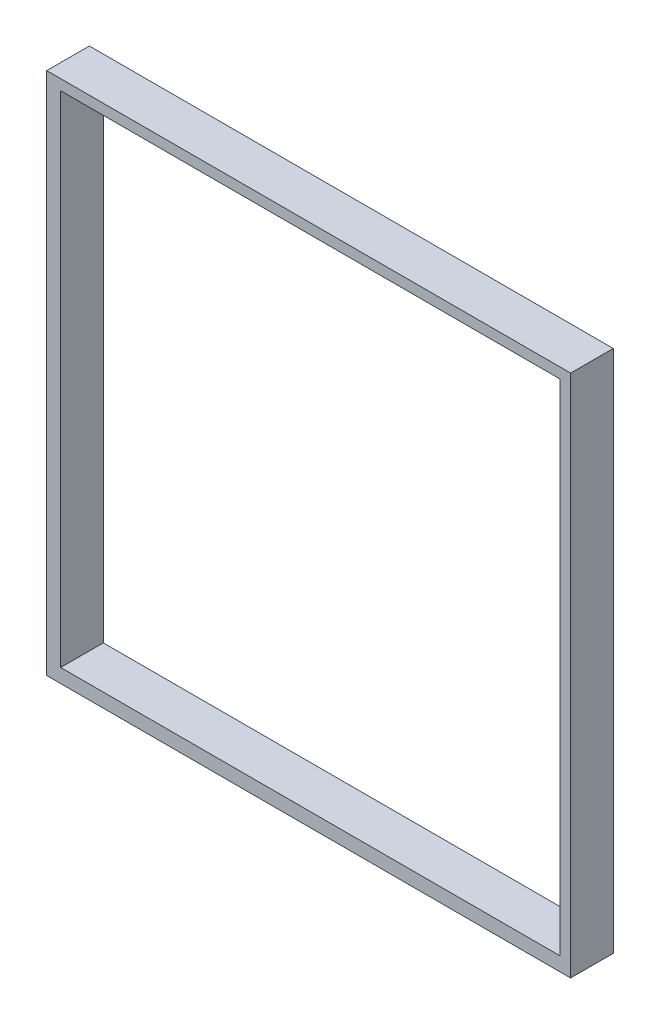
from build123d import *

# Parameters (mm, degrees)
SCHIZZO1_W                   = 43
SCHIZZO1_H                   = 43
ESTRUSIONE_ESTRUSIONE1_DEPTH = 3.5
SCHIZZO8_W                   = 41
SCHIZZO8_H                   = 41
TAGLIO_ESTRUSIONE1_DEPTH     = 15.5


with BuildPart() as part:
    # Schizzo1 → Estrusione-Estrusione1 (new body)
    with BuildSketch(Plane.XY):
        with Locations((21.5, 21.5)):
            Rectangle(SCHIZZO1_W, SCHIZZO1_H)
    extrude(amount=ESTRUSIONE_ESTRUSIONE1_DEPTH)

    # Schizzo8 → Taglio-Estrusione1 (cut)
    with BuildSketch(Plane(origin=(0, 0, 0), x_dir=(-1, 0, 0), z_dir=(0, 0, -1))):
        with Locations((-21.642757503, 21.642757503)):
            Rectangle(SCHIZZO8_W, SCHIZZO8_H)
    extrude(amount=-TAGLIO_ESTRUSIONE1_DEPTH, mode=Mode.SUBTRACT)


solid = part.part
